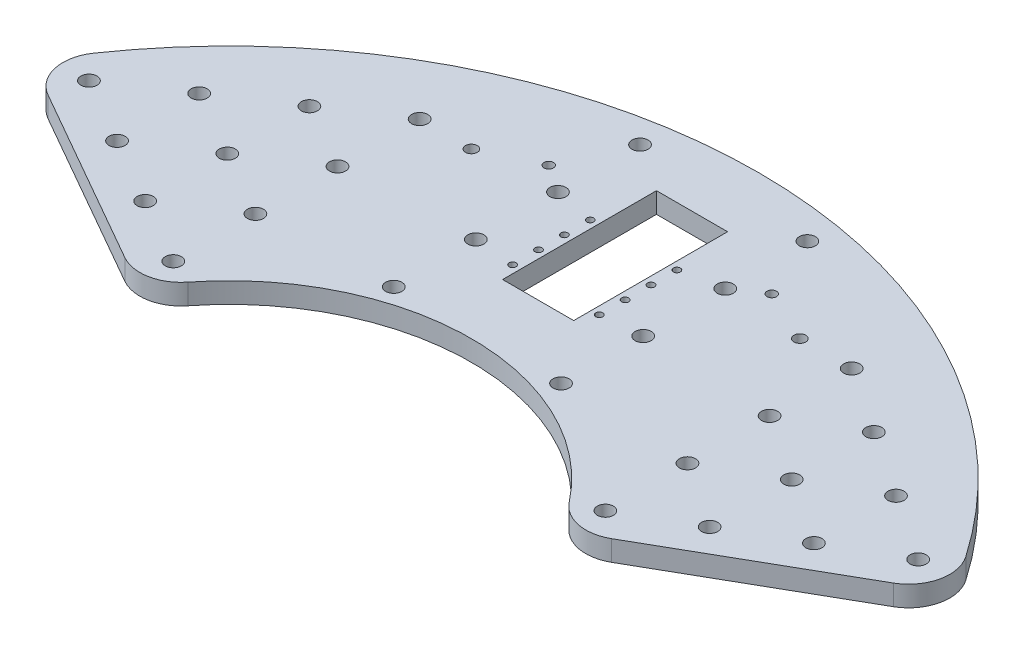
from build123d import *

# Parameters (mm, degrees)
BOSS_EXTRUDE1_DEPTH       = 6.35
F_6_CLEARANCE_HOLE1_D     = 3.6576
F_6_CLEARANCE_HOLE1_DEPTH = 25.4
F_6_CLEARANCE_HOLE1_TIP   = 1.0988539
FILLET1_R                 = 12.7
F_4_CLEARANCE_HOLE1_D     = 2.9464
F_4_CLEARANCE_HOLE1_DEPTH = 25.4
F_4_CLEARANCE_HOLE1_TIP   = 0.885187864
LPATTERN4_COUNT           = 6
LPATTERN4_PITCH           = 25.4
LPATTERN4_COUNT_DIR2      = 7
LPATTERN4_PITCH_DIR2      = 23.622
SKETCH8_W                 = 22
SKETCH8_H                 = 47.6
CUT_EXTRUDE1_DEPTH        = 214.756408018
F_4_CLEARANCE_HOLE3_D     = 2.159


with BuildPart() as part:
    # Sketch1 → Boss-Extrude1 (new body)
    with BuildSketch(Plane(origin=(0, 0, 0), x_dir=(1, 0, 0), z_dir=(0, 1, 0))):
        with BuildLine():
            Line((65.058096917, 37.174573643), (142.24566953, 81.28))
            ThreePointArc((142.24566953, 81.28), (0, 163.83), (-142.24566953, 81.28))
            Line((-142.24566953, 81.28), (-65.058096917, 37.174573643))
            ThreePointArc((-65.058096917, 37.174573643), (0, 74.93), (65.058096917, 37.174573643))
        make_face()
    extrude(amount=BOSS_EXTRUDE1_DEPTH)

    # #6 Clearance Hole1
    with Locations(Plane(origin=(-50.8, 6.35, -125.73), x_dir=(0, 0, 1), z_dir=(0, 1, 0))):
        with Locations((0, 0), (0, 101.6)):
            Hole(F_6_CLEARANCE_HOLE1_D / 2, depth=F_6_CLEARANCE_HOLE1_DEPTH)
            with Locations((0, 0, -(F_6_CLEARANCE_HOLE1_DEPTH + F_6_CLEARANCE_HOLE1_TIP / 2))):  # 118° drill point
                Cone(0, F_6_CLEARANCE_HOLE1_D / 2, F_6_CLEARANCE_HOLE1_TIP, mode=Mode.SUBTRACT)

    # Fillet1
    fillet1_edges = [part.edges().sort_by_distance(p)[0] for p in [
        (65.058096917, 3.175, -37.174573643),
        (-142.24566953, 3.175, -81.28),
        (-65.058096917, 3.175, -37.174573643),
        (142.24566953, 3.175, -81.28),
    ]]
    fillet(fillet1_edges, radius=FILLET1_R)

    # #4 Clearance Hole1
    with Locations(Plane(origin=(0, 6.35, 0), x_dir=(-1, 0, 0), z_dir=(0, 1, 0))):
        with Locations((-34.5, -133.35), (34.5, -133.35)):
            Hole(F_4_CLEARANCE_HOLE1_D / 2, depth=F_4_CLEARANCE_HOLE1_DEPTH)
            with Locations((0, 0, -(F_4_CLEARANCE_HOLE1_DEPTH + F_4_CLEARANCE_HOLE1_TIP / 2))):  # 118° drill point
                Cone(0, F_4_CLEARANCE_HOLE1_D / 2, F_4_CLEARANCE_HOLE1_TIP, mode=Mode.SUBTRACT)

    # Sketch5 → #10 Clearance Hole1 (revolve, cut)
    with BuildSketch(Plane(origin=(-128.255094273, 6.35, -84.874017323), x_dir=(0, 0, 1), z_dir=(1, 0, 0))):
        Polygon((0, 0), (0, 26.895662253), (2.4892, 25.4), (2.4892, 0), align=None)
    f_10_clearance_hole1 = revolve(axis=Axis((-128.255094273, 12.7, -84.874017323), (0, -1, 0)), mode=Mode.SUBTRACT)

    # LPattern4: 10 Clearance Hole1 6 × 7, 28 skipped
    with Locations(*[Vector(0, 0, -1) * (i * LPATTERN4_PITCH) + Vector(0.8667949394357127, 0, 0.49866475007628047) * (j * LPATTERN4_PITCH_DIR2) for i in range(LPATTERN4_COUNT) for j in range(LPATTERN4_COUNT_DIR2) if (i, j) not in ((0, 0), (0, 4), (0, 5), (0, 6), (1, 0), (1, 4), (1, 5), (1, 6), (2, 0), (2, 1), (2, 4), (2, 6), (3, 0), (3, 1), (3, 2), (3, 4), (3, 6), (4, 0), (4, 1), (4, 2), (4, 3), (4, 4), (4, 6), (5, 0), (5, 1), (5, 2), (5, 3), (5, 4), (5, 6))]):
        add(f_10_clearance_hole1, mode=Mode.SUBTRACT)

    # Mirror4 copy 1 sketch → Mirror4 copy 1 (revolve, cut)
    with BuildSketch(Plane(origin=(107.779664214, 6.35, -73.094558596), x_dir=(0, 0, 1), z_dir=(-1, 0, 0))):
        Polygon((0, 0), (0, -26.895662253), (2.4892, -25.4), (2.4892, 0), align=None)
    revolve(axis=Axis((107.779664214, 12.7, -73.094558596), (0, 1, 0)), mode=Mode.SUBTRACT)

    # Mirror4 copy 2 sketch → Mirror4 copy 2 (revolve, cut)
    with BuildSketch(Plane(origin=(87.304234155, 6.35, -61.31509987), x_dir=(0, 0, 1), z_dir=(-1, 0, 0))):
        Polygon((0, 0), (0, -26.895662253), (2.4892, -25.4), (2.4892, 0), align=None)
    revolve(axis=Axis((87.304234155, 12.7, -61.31509987), (0, 1, 0)), mode=Mode.SUBTRACT)

    # Mirror4 copy 3 sketch → Mirror4 copy 3 (revolve, cut)
    with BuildSketch(Plane(origin=(66.828804095, 6.35, -49.535641144), x_dir=(0, 0, 1), z_dir=(-1, 0, 0))):
        Polygon((0, 0), (0, -26.895662253), (2.4892, -25.4), (2.4892, 0), align=None)
    revolve(axis=Axis((66.828804095, 12.7, -49.535641144), (0, 1, 0)), mode=Mode.SUBTRACT)

    # Mirror4 copy 4 sketch → Mirror4 copy 4 (revolve, cut)
    with BuildSketch(Plane(origin=(107.779664214, 6.35, -98.494558596), x_dir=(0, 0, 1), z_dir=(-1, 0, 0))):
        Polygon((0, 0), (0, -26.895662253), (2.4892, -25.4), (2.4892, 0), align=None)
    revolve(axis=Axis((107.779664214, 12.7, -98.494558596), (0, 1, 0)), mode=Mode.SUBTRACT)

    # Mirror4 copy 5 sketch → Mirror4 copy 5 (revolve, cut)
    with BuildSketch(Plane(origin=(87.304234155, 6.35, -86.71509987), x_dir=(0, 0, 1), z_dir=(-1, 0, 0))):
        Polygon((0, 0), (0, -26.895662253), (2.4892, -25.4), (2.4892, 0), align=None)
    revolve(axis=Axis((87.304234155, 12.7, -86.71509987), (0, 1, 0)), mode=Mode.SUBTRACT)

    # Mirror4 copy 6 sketch → Mirror4 copy 6 (revolve, cut)
    with BuildSketch(Plane(origin=(66.828804095, 6.35, -74.935641144), x_dir=(0, 0, 1), z_dir=(-1, 0, 0))):
        Polygon((0, 0), (0, -26.895662253), (2.4892, -25.4), (2.4892, 0), align=None)
    revolve(axis=Axis((66.828804095, 12.7, -74.935641144), (0, 1, 0)), mode=Mode.SUBTRACT)

    # Mirror4 copy 7 sketch → Mirror4 copy 7 (revolve, cut)
    with BuildSketch(Plane(origin=(87.304234155, 6.35, -112.11509987), x_dir=(0, 0, 1), z_dir=(-1, 0, 0))):
        Polygon((0, 0), (0, -26.895662253), (2.4892, -25.4), (2.4892, 0), align=None)
    revolve(axis=Axis((87.304234155, 12.7, -112.11509987), (0, 1, 0)), mode=Mode.SUBTRACT)

    # Mirror4 copy 8 sketch → Mirror4 copy 8 (revolve, cut)
    with BuildSketch(Plane(origin=(66.828804095, 6.35, -100.335641144), x_dir=(0, 0, 1), z_dir=(-1, 0, 0))):
        Polygon((0, 0), (0, -26.895662253), (2.4892, -25.4), (2.4892, 0), align=None)
    revolve(axis=Axis((66.828804095, 12.7, -100.335641144), (0, 1, 0)), mode=Mode.SUBTRACT)

    # Mirror4 copy 9 sketch → Mirror4 copy 9 (revolve, cut)
    with BuildSketch(Plane(origin=(25.877943977, 6.35, -76.776723691), x_dir=(0, 0, 1), z_dir=(-1, 0, 0))):
        Polygon((0, 0), (0, -26.895662253), (2.4892, -25.4), (2.4892, 0), align=None)
    revolve(axis=Axis((25.877943977, 12.7, -76.776723691), (0, 1, 0)), mode=Mode.SUBTRACT)

    # Mirror4 copy 10 sketch → Mirror4 copy 10 (revolve, cut)
    with BuildSketch(Plane(origin=(66.828804095, 6.35, -125.735641144), x_dir=(0, 0, 1), z_dir=(-1, 0, 0))):
        Polygon((0, 0), (0, -26.895662253), (2.4892, -25.4), (2.4892, 0), align=None)
    revolve(axis=Axis((66.828804095, 12.7, -125.735641144), (0, 1, 0)), mode=Mode.SUBTRACT)

    # Mirror4 copy 11 sketch → Mirror4 copy 11 (revolve, cut)
    with BuildSketch(Plane(origin=(25.877943977, 6.35, -102.176723691), x_dir=(0, 0, 1), z_dir=(-1, 0, 0))):
        Polygon((0, 0), (0, -26.895662253), (2.4892, -25.4), (2.4892, 0), align=None)
    revolve(axis=Axis((25.877943977, 12.7, -102.176723691), (0, 1, 0)), mode=Mode.SUBTRACT)

    # Mirror4 copy 12 sketch → Mirror4 copy 12 (revolve, cut)
    with BuildSketch(Plane(origin=(25.877943977, 6.35, -127.576723691), x_dir=(0, 0, 1), z_dir=(-1, 0, 0))):
        Polygon((0, 0), (0, -26.895662253), (2.4892, -25.4), (2.4892, 0), align=None)
    revolve(axis=Axis((25.877943977, 12.7, -127.576723691), (0, 1, 0)), mode=Mode.SUBTRACT)

    # Mirror4 copy 13 sketch → Mirror4 copy 13 (revolve, cut)
    with BuildSketch(Plane(origin=(25.877943977, 6.35, -152.976723691), x_dir=(0, 0, 1), z_dir=(-1, 0, 0))):
        Polygon((0, 0), (0, -26.895662253), (2.4892, -25.4), (2.4892, 0), align=None)
    revolve(axis=Axis((25.877943977, 12.7, -152.976723691), (0, 1, 0)), mode=Mode.SUBTRACT)

    # Mirror4 copy 14 sketch → Mirror4 copy 14 (revolve, cut)
    with BuildSketch(Plane(origin=(128.255094273, 6.35, -84.874017323), x_dir=(0, 0, 1), z_dir=(-1, 0, 0))):
        Polygon((0, 0), (0, -26.895662253), (2.4892, -25.4), (2.4892, 0), align=None)
    revolve(axis=Axis((128.255094273, 12.7, -84.874017323), (0, 1, 0)), mode=Mode.SUBTRACT)

    # Sketch8 → Cut-Extrude1 (cut, through all)
    with BuildSketch(Plane(origin=(0, 6.35, 0), x_dir=(1, 0, 0), z_dir=(0, 1, 0))):
        with Locations((0, 119.38)):
            Rectangle(SKETCH8_W, SKETCH8_H)
    extrude(amount=-CUT_EXTRUDE1_DEPTH, mode=Mode.SUBTRACT)

    # #4 Clearance Hole3 (through all)
    with Locations(Plane(origin=(0, 6.35, 0), x_dir=(-1, 0, 0), z_dir=(0, 1, 0))):
        with Locations((13.4, -125.08), (13.4, -117.08), (13.4, -109.08), (13.4, -101.08), (-13.4, -101.08), (-13.4, -109.08), (-13.4, -117.08), (-13.4, -125.08)):
            Hole(F_4_CLEARANCE_HOLE3_D / 2)


solid = part.part
